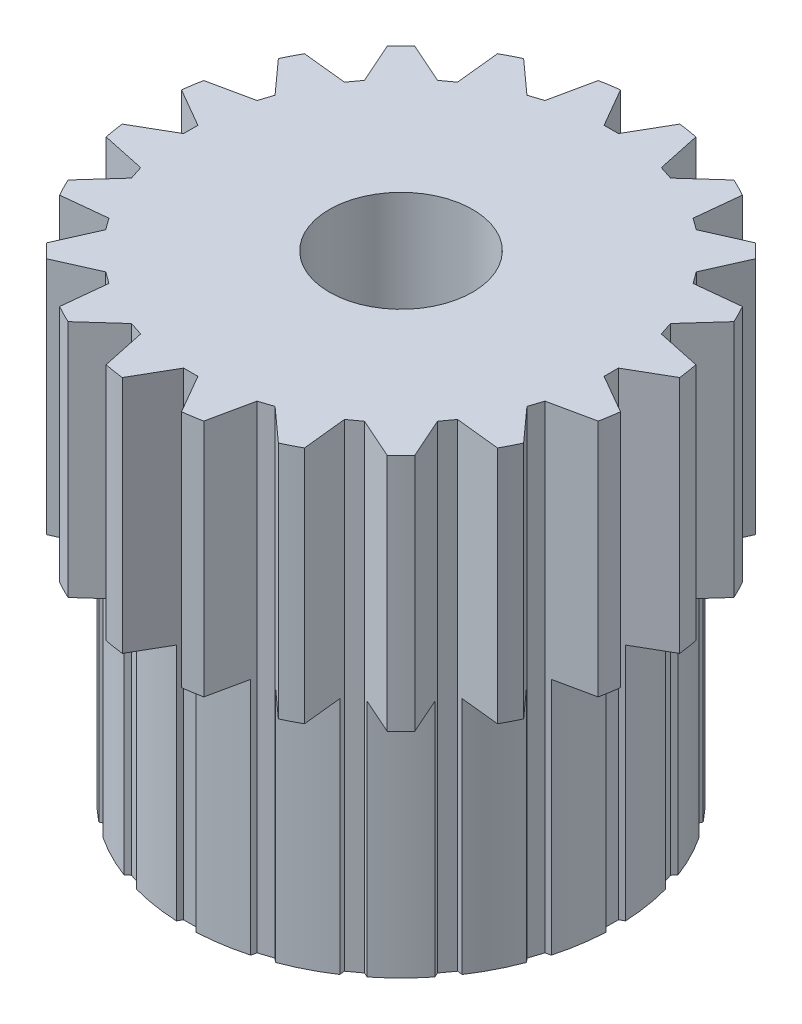
from build123d import *

# Parameters (mm, degrees)
SKETCH_1_R               = 4.5
EXTRUDE_1_DEPTH          = 10
SKETCH_2_R               = 5.25
EXTRUDE_2_DEPTH          = 5
CUT_EXTRUDE_3_DEPTH      = 10
PATTERN_CIRCULAR_2_COUNT = 20
SKETCH_5_R               = 1.5
CUT_EXTRUDE_4_DEPTH      = 10


with BuildPart() as part:
    # 스케치1 → 보스-돌출1 (new body)
    with BuildSketch(Plane(origin=(0, 0, 0), x_dir=(1, 0, 0), z_dir=(0, 1, 0))):
        with Locations(Location((0, 0, 0), (0, 0, 270))):
            Circle(SKETCH_1_R)
    extrude(amount=EXTRUDE_1_DEPTH)

    # 스케치2 → 보스-돌출2 (add)
    with BuildSketch(Plane(origin=(0, 10, 0), x_dir=(1, 0, 0), z_dir=(0, 1, 0))):
        with Locations(Location((0, 0, 0), (0, 0, 270))):
            Circle(SKETCH_2_R)
    extrude(amount=-EXTRUDE_2_DEPTH)

    # 스케치4 → 컷-돌출3 (cut)
    with BuildSketch(Plane(origin=(0, 10, 0), x_dir=(1, 0, 0), z_dir=(0, 1, 0))):
        Polygon((0, 4.4), (0.15, 4.4), (0.727350269, 5.4), (-0.727350269, 5.4), (-0.15, 4.4), align=None)
    cut_extrude_3 = extrude(amount=-CUT_EXTRUDE_3_DEPTH, mode=Mode.SUBTRACT)

    # 원형 패턴2: 컷-돌출3 ×20 about axis
    pattern_circular_2_axis = Axis((0, 0, 0), (0, 1, 0))
    for i in range(1, PATTERN_CIRCULAR_2_COUNT):
        add(cut_extrude_3.rotate(pattern_circular_2_axis, i * 360 / PATTERN_CIRCULAR_2_COUNT), mode=Mode.SUBTRACT)

    # 스케치5 → 컷-돌출4 (cut)
    with BuildSketch(Plane(origin=(0, 10, 0), x_dir=(1, 0, 0), z_dir=(0, 1, 0))):
        with Locations(Location((0, 0, 0), (0, 0, 270))):
            Circle(SKETCH_5_R)
    extrude(amount=-CUT_EXTRUDE_4_DEPTH, mode=Mode.SUBTRACT)


solid = part.part
